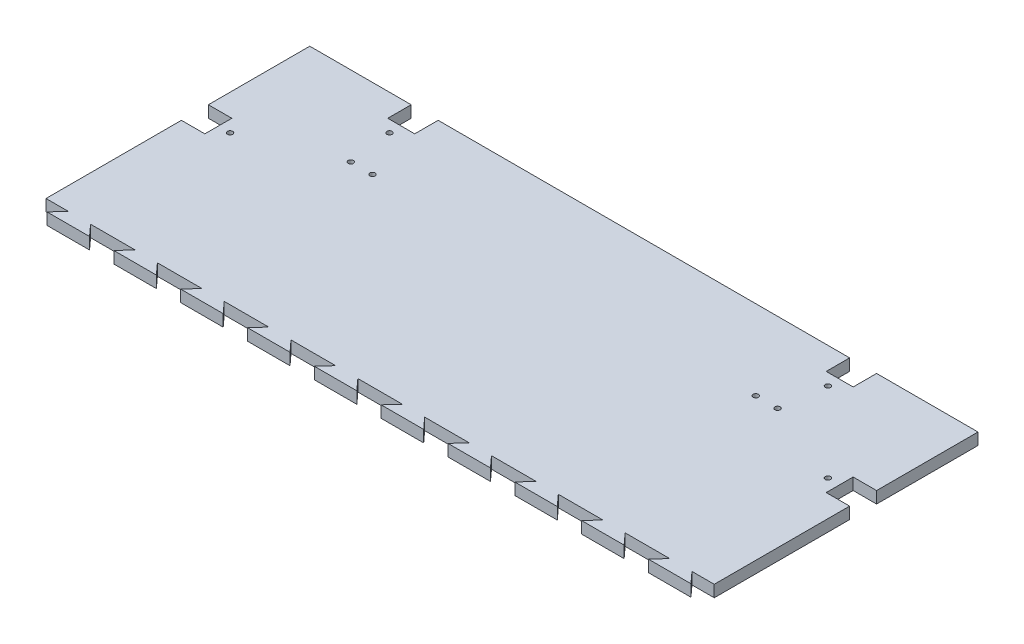
from build123d import *

# Parameters (mm, degrees)
SCHIZZO1_W                   = 570
SCHIZZO1_H                   = 450
ESTRUSIONE_ESTRUSIONE1_DEPTH = 10
SCHIZZO2_R                   = 2.25
SCHIZZO2_W                   = 23
SCHIZZO2_H                   = 20
SCHIZZO2_W_2                 = 20
SCHIZZO2_H_2                 = 23
TAGLIO_ESTRUSIONE1_DEPTH     = 10
TAGLIO_ESTRUSIONE2_DEPTH     = 10


with BuildPart() as part:
    # Schizzo1 → Estrusione-Estrusione1 (new body)
    with BuildSketch(Plane(origin=(0, 0, 0), x_dir=(1, 0, 0), z_dir=(0, 1, 0))):
        with Locations((-285, 225)):
            Rectangle(SCHIZZO1_W, SCHIZZO1_H)
    extrude(amount=ESTRUSIONE_ESTRUSIONE1_DEPTH)

    # Schizzo2 → Taglio-Estrusione1 (cut)
    with BuildSketch(Plane.XZ):
        with Locations(Location((-467, -68, 0), (0, 0, 270))):
            Circle(SCHIZZO2_R)
        with Locations(Location((-448.5, -68, 0), (0, 0, 270))):
            Circle(SCHIZZO2_R)
        with Locations(Location((-121.5, -68, 0), (0, 0, 270))):
            Circle(SCHIZZO2_R)
        with Locations(Location((-103, -68, 0), (0, 0, 270))):
            Circle(SCHIZZO2_R)
        with Locations(Location((-467, -382, 0), (0, 0, 270))):
            Circle(SCHIZZO2_R)
        with Locations(Location((-448.5, -382, 0), (0, 0, 270))):
            Circle(SCHIZZO2_R)
        with Locations(Location((-121.5, -382, 0), (0, 0, 270))):
            Circle(SCHIZZO2_R)
        with Locations(Location((-103, -382, 0), (0, 0, 270))):
            Circle(SCHIZZO2_R)
        with Locations(Location((-472, -420, 0), (0, 0, 270))):
            Circle(SCHIZZO2_R)
        with Locations(Location((-540, -352, 0), (0, 0, 270))):
            Circle(SCHIZZO2_R)
        with Locations(Location((-540, -98, 0), (0, 0, 270))):
            Circle(SCHIZZO2_R)
        with Locations(Location((-472, -30, 0), (0, 0, 270))):
            Circle(SCHIZZO2_R)
        with Locations(Location((-98, -30, 0), (0, 0, 270))):
            Circle(SCHIZZO2_R)
        with Locations(Location((-30, -98, 0), (0, 0, 270))):
            Circle(SCHIZZO2_R)
        with Locations(Location((-30, -352, 0), (0, 0, 270))):
            Circle(SCHIZZO2_R)
        with Locations(Location((-98, -420, 0), (0, 0, 270))):
            Circle(SCHIZZO2_R)
        with Locations((-472, -10)):
            Rectangle(SCHIZZO2_W, SCHIZZO2_H)
        with Locations((-98, -10)):
            Rectangle(SCHIZZO2_W, SCHIZZO2_H)
        with Locations((-10, -98)):
            Rectangle(SCHIZZO2_W_2, SCHIZZO2_H_2)
        with Locations((-10, -352)):
            Rectangle(SCHIZZO2_W_2, SCHIZZO2_H_2)
        with Locations((-98, -440)):
            Rectangle(SCHIZZO2_W, SCHIZZO2_H)
        with Locations((-472, -440)):
            Rectangle(SCHIZZO2_W, SCHIZZO2_H)
        with Locations((-560, -352)):
            Rectangle(SCHIZZO2_W_2, SCHIZZO2_H_2)
        with Locations((-560, -98)):
            Rectangle(SCHIZZO2_W_2, SCHIZZO2_H_2)
    extrude(amount=-TAGLIO_ESTRUSIONE1_DEPTH, mode=Mode.SUBTRACT)

    # Schizzo3 → Taglio-Estrusione2 (cut)
    with BuildSketch(Plane.XZ):
        Polygon((-570, -225), (-551, -225), (-559.645, -215.5), (-523.355, -215.5), (-532, -225), (-513, -225), (-494, -225), (-502.645, -215.5), (-466.355, -215.5), (-475, -225), (-456, -225), (-437, -225), (-445.645, -215.5), (-409.355, -215.5), (-418, -225), (-399, -225), (-380, -225), (-388.645, -215.5), (-352.355, -215.5), (-361, -225), (-342, -225), (-323, -225), (-331.645, -215.5), (-295.355, -215.5), (-304, -225), (-285, -225), (-266, -225), (-274.645, -215.5), (-238.355, -215.5), (-247, -225), (-228, -225), (-209, -225), (-217.645, -215.5), (-181.355, -215.5), (-190, -225), (-171, -225), (-152, -225), (-160.645, -215.5), (-124.355, -215.5), (-133, -225), (-114, -225), (-95, -225), (-103.645, -215.5), (-67.355, -215.5), (-76, -225), (-57, -225), (-38, -225), (-46.645, -215.5), (-10.355, -215.5), (-19, -225), (0, -225), (0, 0), (-570, 0), align=None)
    extrude(amount=-TAGLIO_ESTRUSIONE2_DEPTH, mode=Mode.SUBTRACT)


solid = part.part
